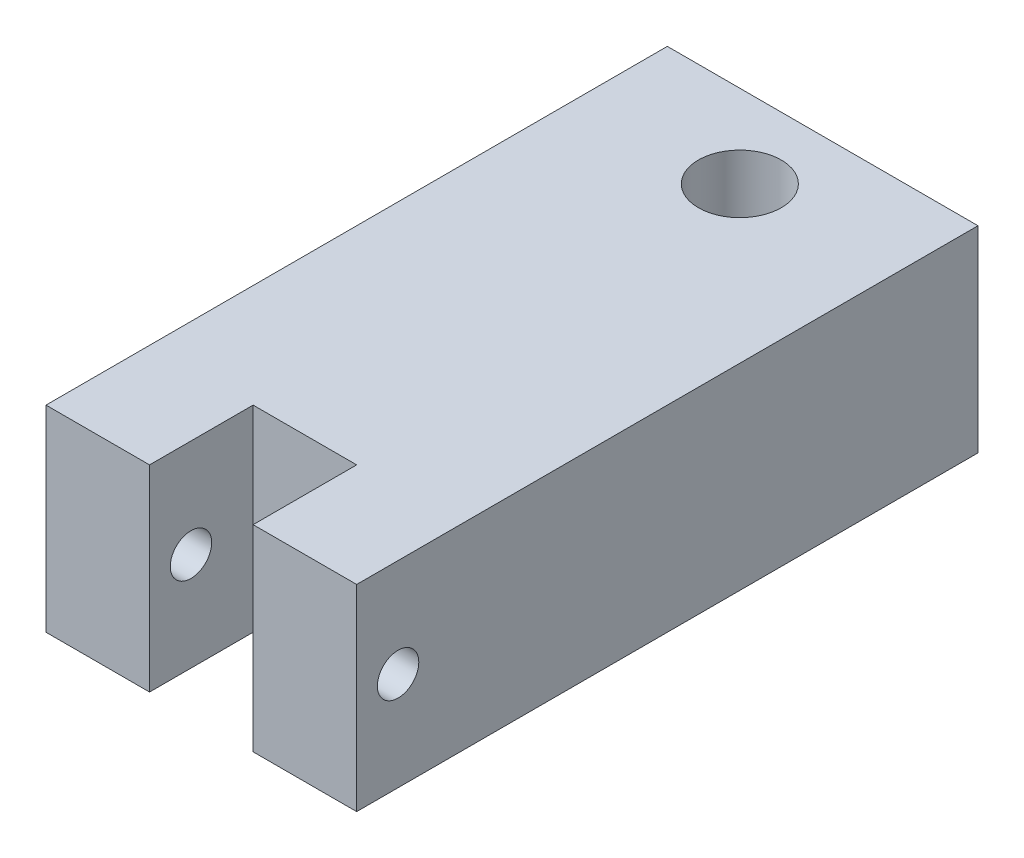
from build123d import *

# Parameters (mm, degrees)
BOSS_EXTRUDE1_DEPTH = 95
SKETCH3_R           = 20
CUT_EXTRUDE2_DEPTH  = 327
SKETCH4_R           = 10
CUT_EXTRUDE3_DEPTH  = 260
SKETCH5_W           = 50
SKETCH5_H           = 95.125248012
CUT_EXTRUDE4_DEPTH  = 50
SCALE1_SCALE        = 0.75


with BuildPart() as part:
    # Sketch1 → Boss-Extrude1 (new body)
    with BuildSketch(Plane(origin=(0, 0, 0), x_dir=(1, 0, 0), z_dir=(0, 1, 0))):
        Polygon((72.999601763, 104.000796475), (97.999601763, 104.000796475), (97.999601763, -195.999203525), (72.999601763, -195.999203525), (22.999601763, -195.999203525), (-52.000398237, -195.999203525), (-52.000398237, 104.000796475), (22.999601763, 104.000796475), align=None)
    extrude(amount=BOSS_EXTRUDE1_DEPTH)

    # Sketch3 → Cut-Extrude2 (cut)
    with BuildSketch(Plane(origin=(0, 95, 0), x_dir=(1, 0, 0), z_dir=(0, 1, 0))):
        with Locations(Location((22.999601763, 64.000796475, 0), (0, 0, 270))):
            Circle(SKETCH3_R)
    extrude(amount=-CUT_EXTRUDE2_DEPTH, mode=Mode.SUBTRACT)

    # Sketch4 → Cut-Extrude3 (cut)
    with BuildSketch(Plane(origin=(97.999601763, 0, 0), x_dir=(0, 0, -1), z_dir=(1, 0, 0))):
        with Locations((-175.999203525, 47.5)):
            Circle(SKETCH4_R)
    extrude(amount=-CUT_EXTRUDE3_DEPTH, mode=Mode.SUBTRACT)

    # Sketch5 → Cut-Extrude4 (cut)
    with BuildSketch(Plane.XY.offset(195.999203525)):
        with Locations((22.999601763, 47.562624006)):
            Rectangle(SKETCH5_W, SKETCH5_H)
    extrude(amount=-CUT_EXTRUDE4_DEPTH, mode=Mode.SUBTRACT)


with BuildPart() as part_1:
    # Scale1: scaled about (22.999601763, 47.5, 40.688864602)
    add(part.part.scale(SCALE1_SCALE).moved(Location((5.749900441, 11.875, 10.172216151))))


solid = part_1.part
